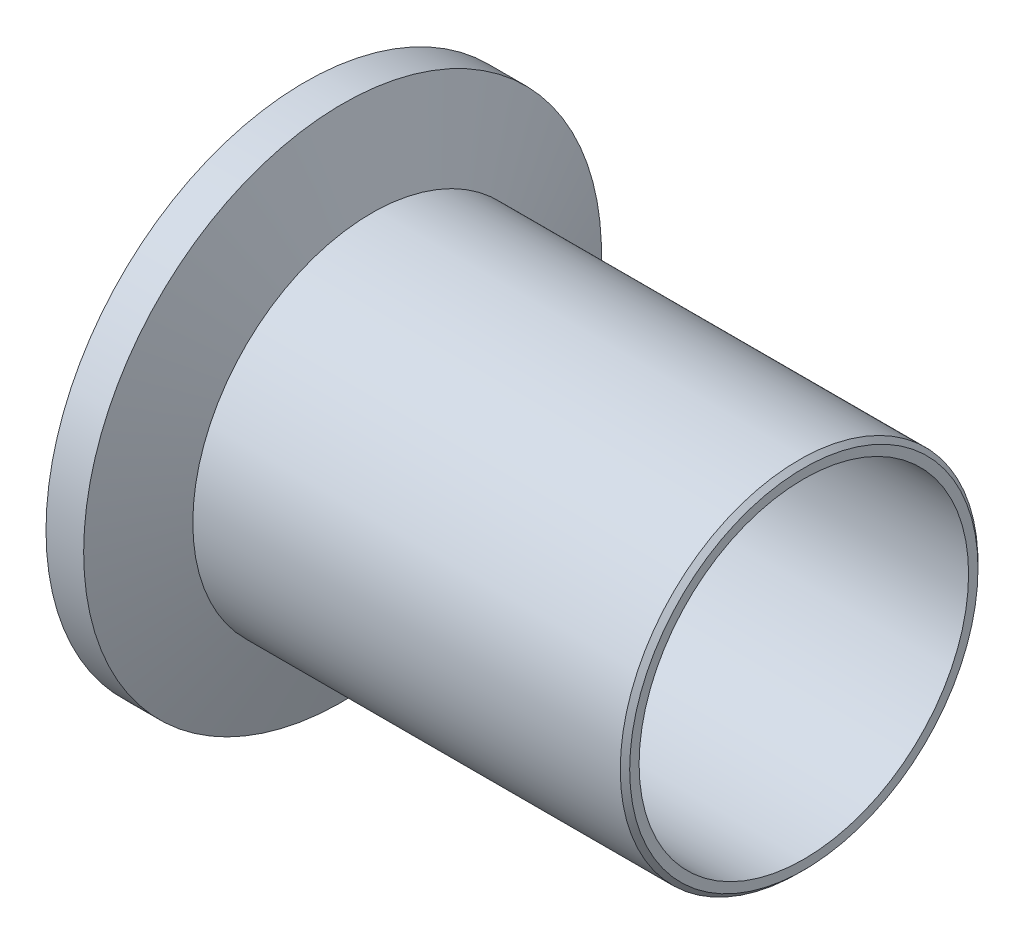
from build123d import *

# Parameters (mm, degrees)
SKETCH_2_R          = 20.5
CUT_EXTRUDE_1_DEPTH = 3
SKETCH_3_R          = 18
CUT_EXTRUDE_2_DEPTH = 0.5
CHAMFER_1_SIZE      = 0.5


with BuildPart() as part:
    # 스케치1 → 회전1 (revolve)
    with BuildSketch(Plane.XY, mode=Mode.PRIVATE) as revolve_1_sk:
        Polygon((0, 17.5), (0, 27.5), (4, 27.5), (7.093746991, 19), (53, 19), (53, 17.5), align=None)
    revolve(revolve_1_sk.sketch.rotate(Axis((0, 0, 0), (1, 0, 0)), 90), axis=Axis((0, 0, 0), (1, 0, 0)))

    # 스케치2 → 컷-돌출1 (cut)
    with BuildSketch(Plane.ZY):
        Circle(SKETCH_2_R)
    extrude(amount=-CUT_EXTRUDE_1_DEPTH, mode=Mode.SUBTRACT)

    # 스케치3 → 컷-돌출2 (cut)
    with BuildSketch(Plane.ZY.offset(-3)):
        Circle(SKETCH_3_R)
    extrude(amount=-CUT_EXTRUDE_2_DEPTH, mode=Mode.SUBTRACT)

    # 모따기1
    chamfer_1_edges = [part.edges().sort_by_distance(p)[0] for p in [
        (53, 0, -19),
    ]]
    chamfer(chamfer_1_edges, length=CHAMFER_1_SIZE)


solid = part.part
